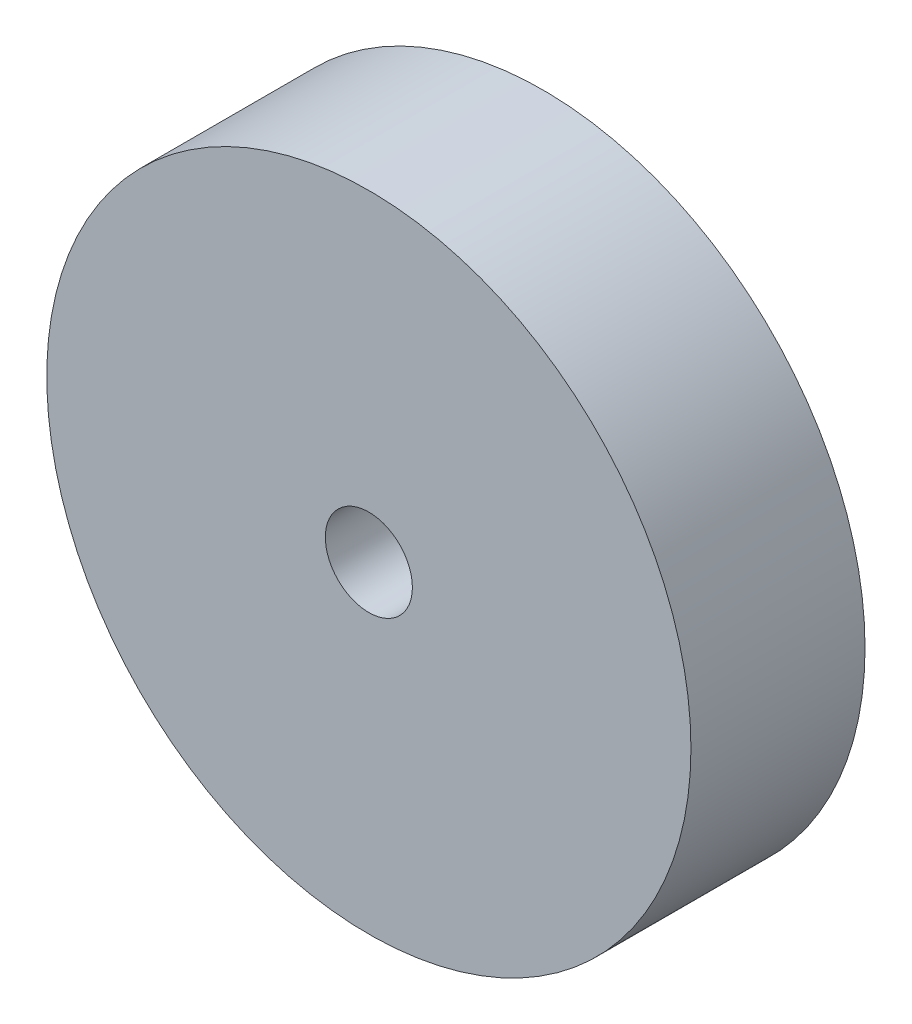
from build123d import *

# Parameters (mm, degrees)
ESQUISSE1_R           = 9.25
ESQUISSE1_R_2         = 0.75
BOSS_EXTRU_1_DEPTH    = 5
TROU_TARAUD_M3X0_51_D = 2.5


with BuildPart() as part:
    # Esquisse1 → Boss.-Extru.1 (new body)
    with BuildSketch(Plane.XY):
        Circle(ESQUISSE1_R)
        Circle(ESQUISSE1_R_2, mode=Mode.SUBTRACT)
    extrude(amount=BOSS_EXTRU_1_DEPTH)

    # Trou taraudé M3x0.51 (through all)
    with Locations(Plane.XY.offset(5)):
        with Locations((0, 0)):
            Hole(TROU_TARAUD_M3X0_51_D / 2)


solid = part.part
